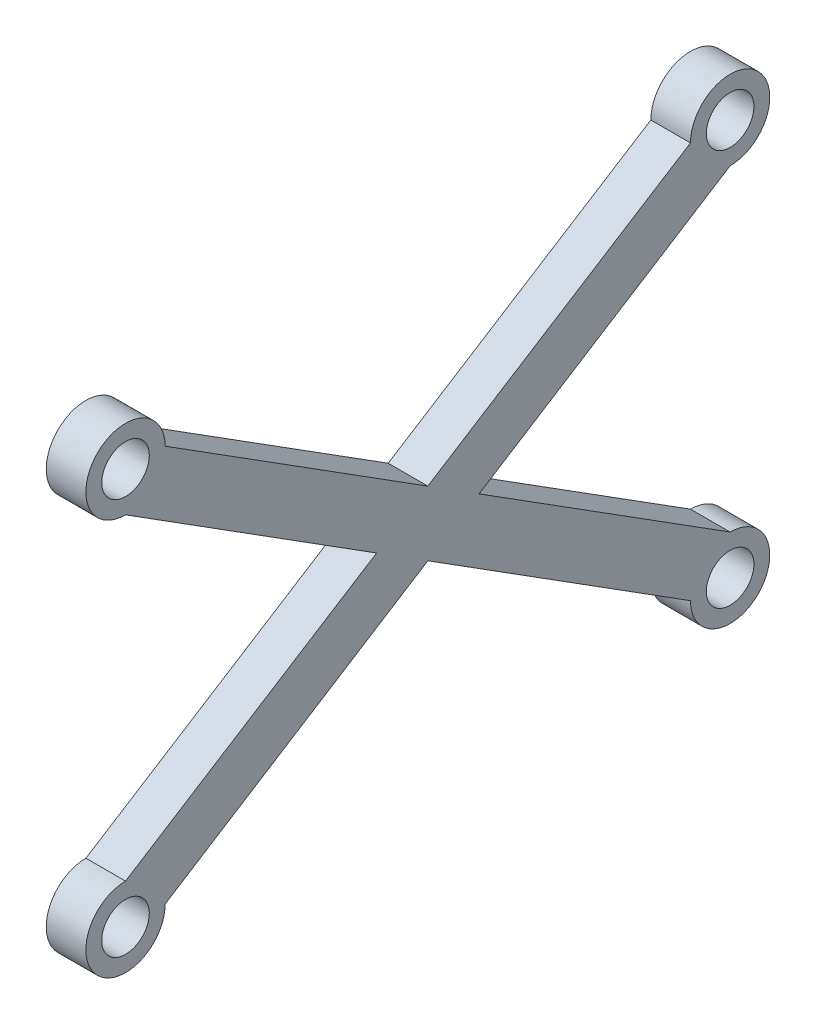
from build123d import *

# Parameters (mm, degrees)
BOSS_EXTRUDE1_DEPTH  = 2
M2_CLEARANCE_HOLE1_D = 2.4


with BuildPart() as part:
    # Sketch1 → Boss-Extrude1 (new body)
    with BuildSketch(Plane.YZ):
        with BuildLine():
            Line((-10, 13.25), (-1.631578947, 0))
            Line((-1.631578947, 0), (-10, -13.25))
            ThreePointArc((-10, -13.25), (-11.414213562, -16.664213562), (-8, -15.25))
            Line((-8, -15.25), (0, -2.583333333))
            Line((0, -2.583333333), (8, -15.25))
            ThreePointArc((8, -15.25), (11.414213562, -16.664213562), (10, -13.25))
            Line((10, -13.25), (1.631578947, 0))
            Line((1.631578947, 0), (10, 13.25))
            ThreePointArc((10, 13.25), (11.414213562, 16.664213562), (8, 15.25))
            Line((8, 15.25), (0, 2.583333333))
            Line((0, 2.583333333), (-8, 15.25))
            ThreePointArc((-8, 15.25), (-11.414213562, 16.664213562), (-10, 13.25))
        make_face()
    extrude(amount=BOSS_EXTRUDE1_DEPTH)

    # M2 Clearance Hole1 (through all)
    with Locations(Plane(origin=(2, 0, 0), x_dir=(0, 0, -1), z_dir=(1, 0, 0))):
        with Locations((15.25, 10), (15.25, -10), (-15.25, 10), (-15.25, -10)):
            Hole(M2_CLEARANCE_HOLE1_D / 2)


solid = part.part
